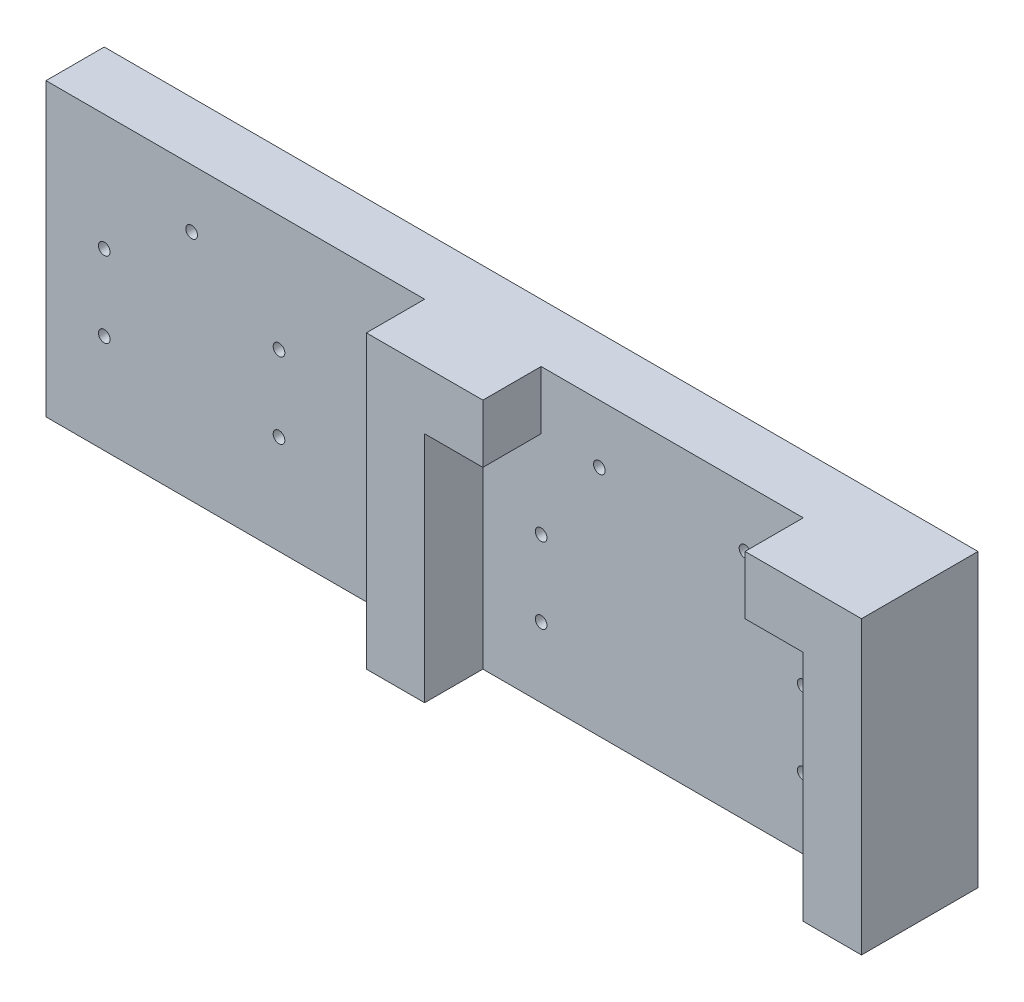
from build123d import *

# Parameters (mm, degrees)
ESQUISSE1_W        = 150
ESQUISSE1_H        = 50
ESQUISSE1_R        = 1
BOSS_EXTRU_4_DEPTH = 10
BOSS_EXTRU_5_DEPTH = 10


with BuildPart() as part:
    # Esquisse1 → Boss.-Extru.4 (new body)
    with BuildSketch(Plane(origin=(0, 0, -20), x_dir=(-1, 0, 0), z_dir=(0, 0, -1))):
        with Locations((11.141434162, -115.464178298)):
            Rectangle(ESQUISSE1_W, ESQUISSE1_H)
        with Locations((-43.858565838, -128.464178298)):
            Circle(ESQUISSE1_R, mode=Mode.SUBTRACT)
        with Locations((-43.858565838, -115.464178298)):
            Circle(ESQUISSE1_R, mode=Mode.SUBTRACT)
        with Locations((-33.858565838, -100.464178298)):
            Circle(ESQUISSE1_R, mode=Mode.SUBTRACT)
        with Locations((-8.858565838, -100.464178298)):
            Circle(ESQUISSE1_R, mode=Mode.SUBTRACT)
        with Locations((1.141434162, -115.464178298)):
            Circle(ESQUISSE1_R, mode=Mode.SUBTRACT)
        with Locations((1.141434162, -128.464178298)):
            Circle(ESQUISSE1_R, mode=Mode.SUBTRACT)
        with Locations((46.141434162, -123.464178298)):
            Circle(ESQUISSE1_R, mode=Mode.SUBTRACT)
        with Locations((46.141434162, -110.464178298)):
            Circle(ESQUISSE1_R, mode=Mode.SUBTRACT)
        with Locations((61.141434162, -100.464178298)):
            Circle(ESQUISSE1_R, mode=Mode.SUBTRACT)
        with Locations((76.141434162, -110.464178298)):
            Circle(ESQUISSE1_R, mode=Mode.SUBTRACT)
        with Locations((76.141434162, -123.464178298)):
            Circle(ESQUISSE1_R, mode=Mode.SUBTRACT)
    extrude(amount=BOSS_EXTRU_4_DEPTH)

    # Esquisse3 → Boss.-Extru.5 (add)
    with BuildSketch(Plane.XY.offset(-20)):
        Polygon((-1.141434162, -100.464178298), (-1.141434162, -90.464178298), (-21.141434162, -90.464178298), (-21.141434162, -140.464178298), (-11.141434162, -140.464178298), (-11.141434162, -100.464178298), align=None)
        Polygon((63.858565838, -140.464178298), (63.858565838, -90.464178298), (43.858565838, -90.464178298), (43.858565838, -100.464178298), (53.858565838, -100.464178298), (53.858565838, -140.464178298), align=None)
    extrude(amount=BOSS_EXTRU_5_DEPTH)


solid = part.part
